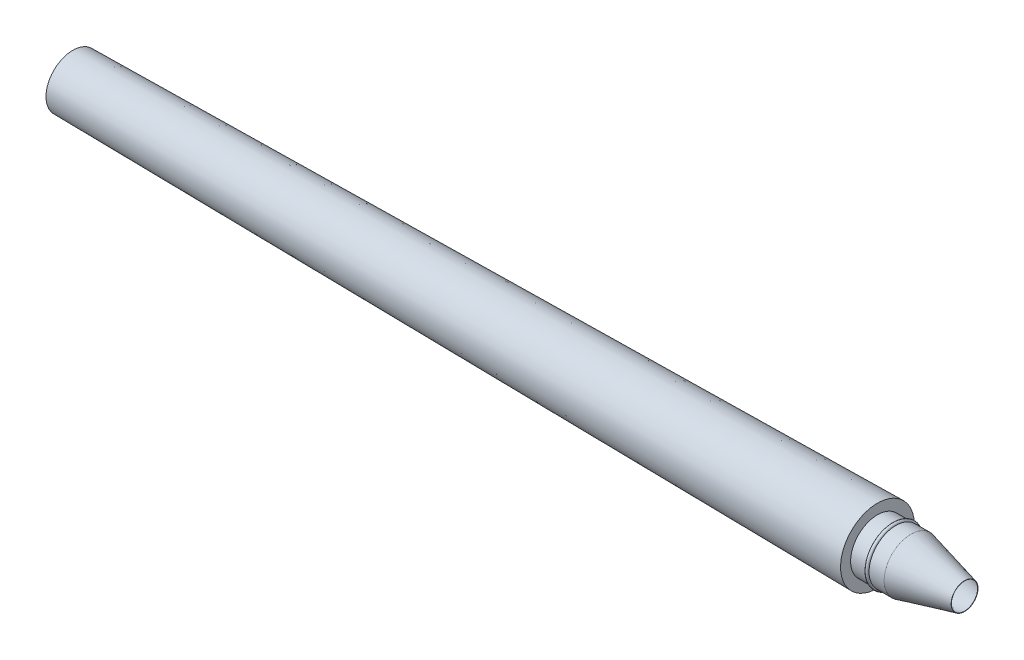
from build123d import *


with BuildPart() as part:
    # 草图1 → 旋转-薄壁4 (revolve)
    with BuildSketch(Plane.XY, mode=Mode.PRIVATE) as revolve_4_sk:
        with BuildLine():
            Line((-66.5, 0), (-66.5, 4))
            Line((-66.5, 4), (53.5, 5.5))
            Line((53.5, 5.5), (53.5, 4))
            Line((53.5, 4), (55.75, 4))
            ThreePointArc((55.75, 4), (56, 4.25), (56.25, 4))
            Line((56.25, 4), (58.5, 4))
            Line((58.5, 4), (66.5, 2))
            Line((66.5, 2), (66.487873219, 1.951492875))
            Line((66.487873219, 1.951492875), (58.493844719, 3.95))
            Line((58.493844719, 3.95), (56.193649167, 3.95))
            ThreePointArc((56.193649167, 3.95), (56, 4.2), (55.806350833, 3.95))
            Line((55.806350833, 3.95), (53.45, 3.95))
            Line((53.45, 3.95), (53.45, 5.449371094))
            Line((53.45, 5.449371094), (-66.45, 3.950621094))
            Line((-66.45, 3.950621094), (-66.45, 0))
            Line((-66.45, 0), (-66.5, 0))
        make_face()
    revolve(revolve_4_sk.sketch.rotate(Axis((-66.5, 0, 0), (1, 0, 0)), 180), axis=Axis((-66.5, 0, 0), (1, 0, 0)))


solid = part.part
